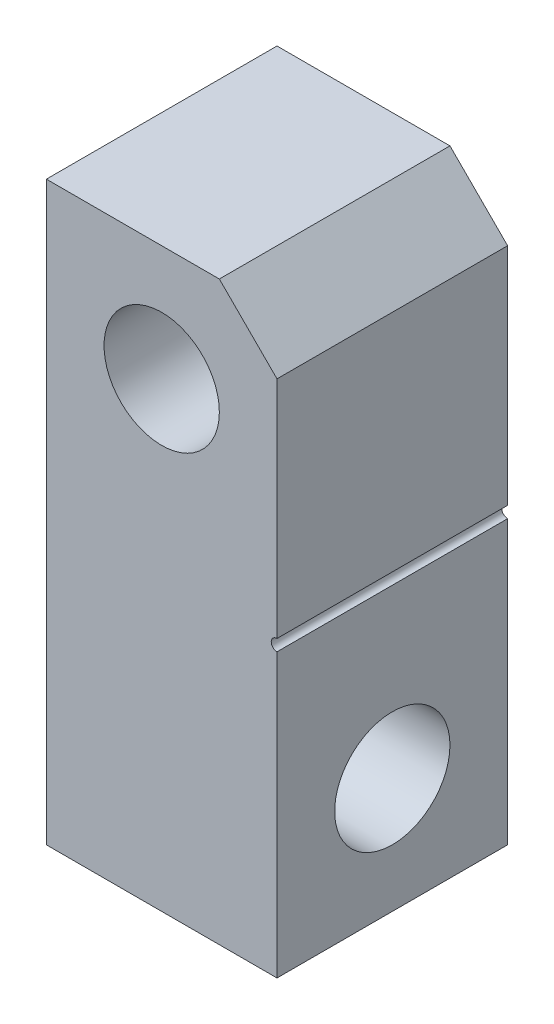
from build123d import *

# Parameters (mm, degrees)
SKETCH1_W           = 20
SKETCH1_H           = 50
BOSS_EXTRUDE1_DEPTH = 20
CUT_EXTRUDE1_DEPTH  = 58.445626465
SKETCH3_R           = 5
CUT_EXTRUDE2_DEPTH  = 58.445626465
SKETCH4_R           = 5
CUT_EXTRUDE3_DEPTH  = 58.445626465
SKETCH5_R           = 0.5
CUT_EXTRUDE4_DEPTH  = 58.445626465


with BuildPart() as part:
    # Sketch1 → Boss-Extrude1 (new body)
    with BuildSketch(Plane.XY):
        with Locations((10, 25)):
            Rectangle(SKETCH1_W, SKETCH1_H)
    extrude(amount=-BOSS_EXTRUDE1_DEPTH)

    # Sketch2 → Cut-Extrude1 (cut, through all)
    with BuildSketch(Plane.XY):
        Polygon((20, 50), (20, 45), (15, 50), align=None)
    extrude(amount=-CUT_EXTRUDE1_DEPTH, mode=Mode.SUBTRACT)

    # Sketch3 → Cut-Extrude2 (cut, through all)
    with BuildSketch(Plane(origin=(20, 0, 0), x_dir=(0, 0, -1), z_dir=(1, 0, 0))):
        with Locations((10, 10)):
            Circle(SKETCH3_R)
    extrude(amount=-CUT_EXTRUDE2_DEPTH, mode=Mode.SUBTRACT)

    # Sketch4 → Cut-Extrude3 (cut, through all)
    with BuildSketch(Plane.XY):
        with Locations((10, 40)):
            Circle(SKETCH4_R)
    extrude(amount=-CUT_EXTRUDE3_DEPTH, mode=Mode.SUBTRACT)

    # Sketch5 → Cut-Extrude4 (cut, through all)
    with BuildSketch(Plane.XY):
        with Locations((20, 25)):
            Circle(SKETCH5_R)
    extrude(amount=-CUT_EXTRUDE4_DEPTH, mode=Mode.SUBTRACT)


solid = part.part
